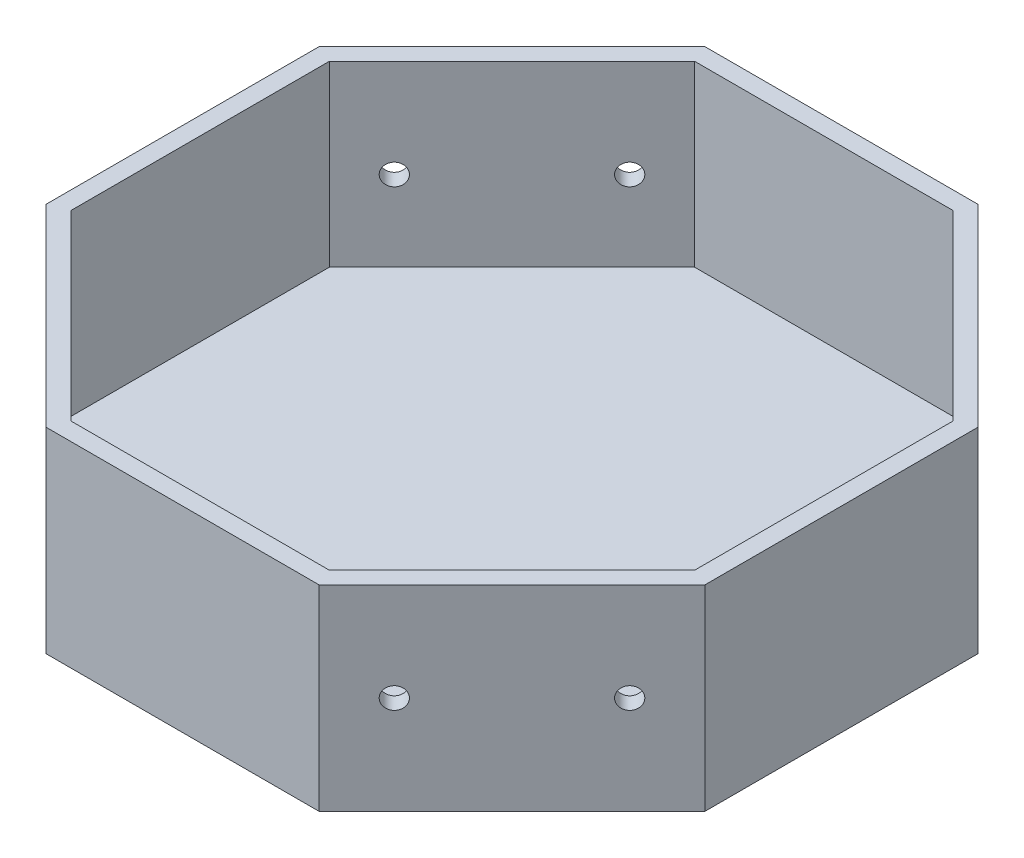
from build123d import *

# Parameters (mm, degrees)
BOSS_EXTRUDE1_DEPTH = 3
BOSS_EXTRUDE2_DEPTH = 30
CUT_EXTRUDE1_REACH  = 139.835
SKETCH3_R           = 1.8
CIRPATTERN1_COUNT   = 4


with BuildPart() as part:
    # Sketch1 → Boss-Extrude1 (new body)
    with BuildSketch(Plane(origin=(0, 0, 0), x_dir=(1, 0, 0), z_dir=(0, 1, 0))):
        Polygon((55.432771951, 22.961005942), (22.961005942, 55.432771951), (-22.961005942, 55.432771951), (-55.432771951, 22.961005942), (-55.432771951, -22.961005942), (-22.961005942, -55.432771951), (22.961005942, -55.432771951), (55.432771951, -22.961005942), align=None)
    extrude(amount=BOSS_EXTRUDE1_DEPTH)

    # Sketch2 → Boss-Extrude2 (add)
    with BuildSketch(Plane(origin=(0, 3, 0), x_dir=(1, 0, 0), z_dir=(0, 1, 0))):
        Polygon((55.432771951, -22.961005942), (55.432771951, 22.961005942), (22.961005942, 55.432771951), (-22.961005942, 55.432771951), (-55.432771951, 22.961005942), (-55.432771951, -22.961005942), (-22.961005942, -55.432771951), (22.961005942, -55.432771951), align=None)
        Polygon((52.432771951, -21.718365255), (52.432771951, 21.718365255), (21.718365255, 52.432771951), (-21.718365255, 52.432771951), (-52.432771951, 21.718365255), (-52.432771951, -21.718365255), (-21.718365255, -52.432771951), (21.718365255, -52.432771951), align=None, mode=Mode.SUBTRACT)
    extrude(amount=BOSS_EXTRUDE2_DEPTH)

    # Sketch3 → Cut-Extrude1 (cut, up to next)
    with BuildSketch(Plane(origin=(39.196888946, 0, 39.196888946), x_dir=(0.7071067811865475, 0, -0.7071067811865477), z_dir=(0.7071067811865477, 0, 0.7071067811865475)), mode=Mode.PRIVATE) as cut_extrude1_sk1:
        with Locations((-14, 16.5)):
            Circle(SKETCH3_R)
    cut_extrude1_tool1 = extrude(cut_extrude1_sk1.sketch, amount=-CUT_EXTRUDE1_REACH, mode=Mode.PRIVATE) & part.part
    # Sketch3 → Cut-Extrude1 (cut, up to next)
    with BuildSketch(Plane(origin=(39.196888946, 0, 39.196888946), x_dir=(0.7071067811865475, 0, -0.7071067811865477), z_dir=(0.7071067811865477, 0, 0.7071067811865475)), mode=Mode.PRIVATE) as cut_extrude1_sk2:
        with Locations((14, 16.5)):
            Circle(SKETCH3_R)
    cut_extrude1_tool2 = extrude(cut_extrude1_sk2.sketch, amount=-CUT_EXTRUDE1_REACH, mode=Mode.PRIVATE) & part.part
    cut_extrude1_1 = cut_extrude1_tool1.solids().sort_by_distance((29.297394, 16.5, 49.096384))[0]
    add(cut_extrude1_1, mode=Mode.SUBTRACT)
    cut_extrude1_2 = cut_extrude1_tool2.solids().sort_by_distance((49.096384, 16.5, 29.297394))[0]
    add(cut_extrude1_2, mode=Mode.SUBTRACT)
    cut_extrude1 = cut_extrude1_1 + cut_extrude1_2  # Cut-Extrude1 as one shape, for the pattern or mirror that repeats it

    # CirPattern1: Cut-Extrude1 ×4 about axis
    cirpattern1_axis = Axis((0, 0, 0), (0, 1, 0))
    for i in range(1, CIRPATTERN1_COUNT):
        add(cut_extrude1.rotate(cirpattern1_axis, i * 360 / CIRPATTERN1_COUNT), mode=Mode.SUBTRACT)


solid = part.part
